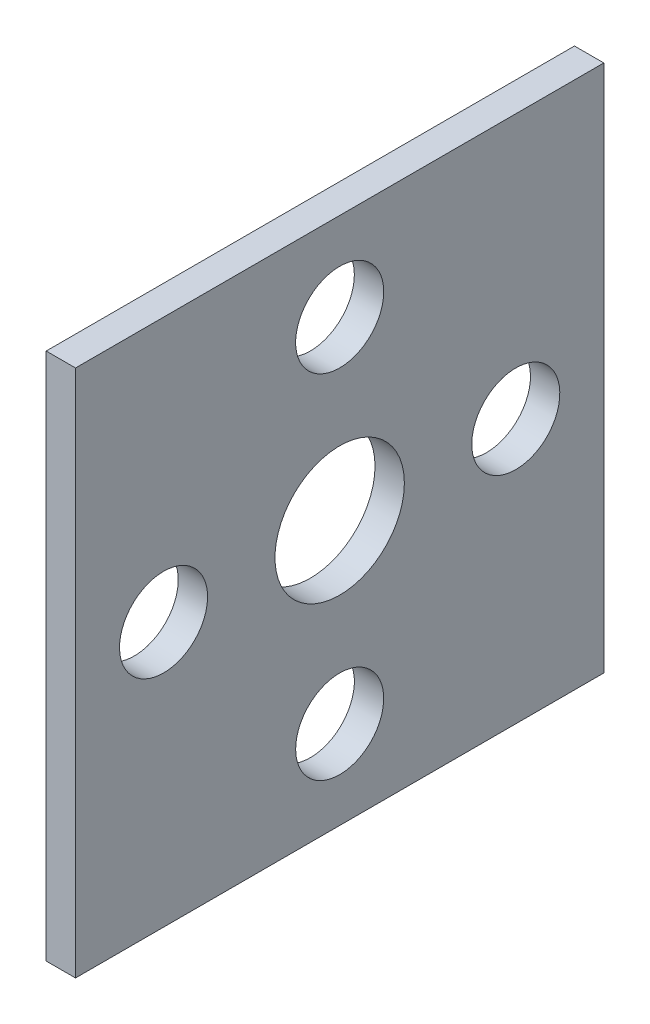
from build123d import *

# Parameters (mm, degrees)
SKETCH1_W           = 57.15
SKETCH1_H           = 57.15
SKETCH1_R           = 6.99897
BOSS_EXTRUDE1_DEPTH = 3.175
SKETCH2_R           = 4.7625
CUT_EXTRUDE1_DEPTH  = 41.535686438
CIRPATTERN1_COUNT   = 4


with BuildPart() as part:
    # Sketch1 → Boss-Extrude1 (new body)
    with BuildSketch(Plane(origin=(0, 0, 0), x_dir=(0, 0, -1), z_dir=(1, 0, 0))):
        Rectangle(SKETCH1_W, SKETCH1_H)
        Circle(SKETCH1_R, mode=Mode.SUBTRACT)
    extrude(amount=BOSS_EXTRUDE1_DEPTH)

    # Sketch2 → Cut-Extrude1 (cut, through all)
    with BuildSketch(Plane(origin=(0, 0, 0), x_dir=(0, 0, -1), z_dir=(1, 0, 0))):
        with Locations((0, 19.05)):
            Circle(SKETCH2_R)
    cut_extrude1 = extrude(amount=CUT_EXTRUDE1_DEPTH, mode=Mode.SUBTRACT)

    # CirPattern1: Cut-Extrude1 ×4 about axis
    cirpattern1_axis = Axis((0, 0, 0), (1, 0, 0))
    for i in range(1, CIRPATTERN1_COUNT):
        add(cut_extrude1.rotate(cirpattern1_axis, i * 360 / CIRPATTERN1_COUNT), mode=Mode.SUBTRACT)


solid = part.part
